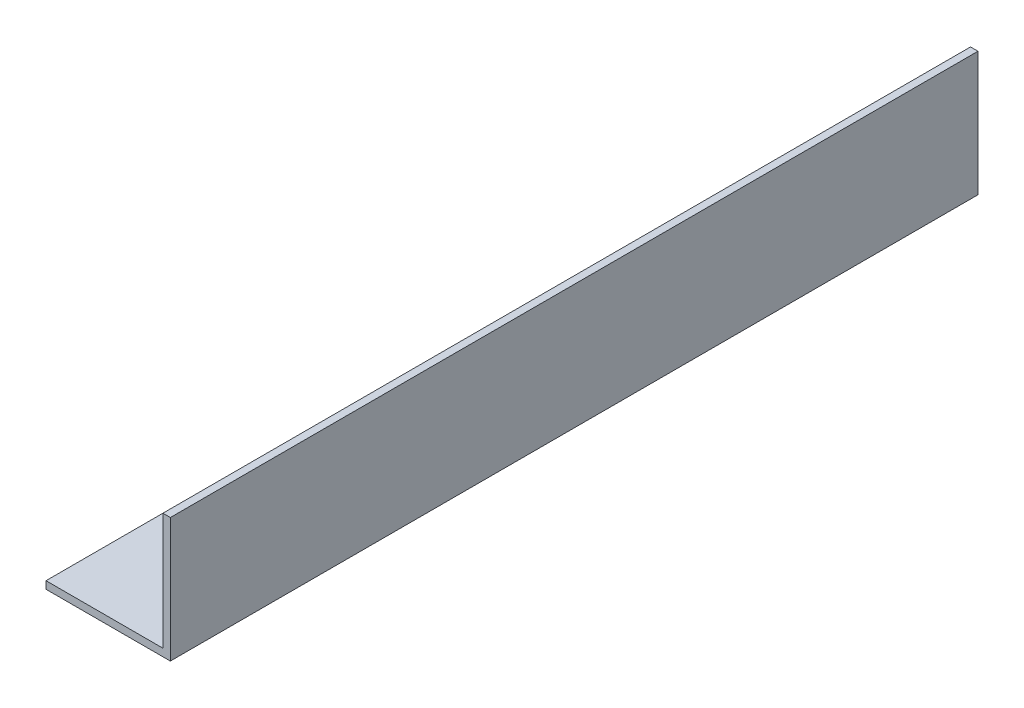
from build123d import *

# Parameters (mm, degrees)
BOSS_EXTRUDE1_DEPTH      = 20
BOSS_EXTRUDE1_DEPTH_BACK = 304.8
SKETCH4_R                = 2.585
CUT_EXTRUDE1_DEPTH       = 313.894614847


with BuildPart() as part:
    # Sketch3 → Boss-Extrude1 (new, two sides: drawn at the far end of the back side and taken through both)
    with BuildSketch(Plane.XY.offset(-BOSS_EXTRUDE1_DEPTH_BACK)):
        Polygon((-50, 0), (0, 0), (0, 50), (-3, 50), (-3, 3), (-50, 3), align=None)
    extrude(amount=BOSS_EXTRUDE1_DEPTH + BOSS_EXTRUDE1_DEPTH_BACK)

    # Sketch4 → Cut-Extrude1 (cut, through all)
    with BuildSketch(Plane(origin=(0, 0, 0), x_dir=(1, 0, 0), z_dir=(0, 1, 0))):
        with Locations(Location((-37, 151.19, 0), (0, 0, 180))):
            Circle(SKETCH4_R)
        with Locations(Location((-16, 151.19, 0), (0, 0, 90))):
            Circle(SKETCH4_R)
        with Locations(Location((-37, 179.19, 0), (0, 0, 180))):
            Circle(SKETCH4_R)
        with Locations(Location((-16, 179.19, 0), (0, 0, 90))):
            Circle(SKETCH4_R)
        with Locations(Location((-37, 105.61, 0), (0, 0, 90))):
            Circle(SKETCH4_R)
        with Locations(Location((-16, 105.61, 0), (0, 0, 180))):
            Circle(SKETCH4_R)
        with Locations(Location((-16, 133.61, 0), (0, 0, 180))):
            Circle(SKETCH4_R)
        with Locations(Location((-37, 133.61, 0), (0, 0, 90))):
            Circle(SKETCH4_R)
    extrude(amount=CUT_EXTRUDE1_DEPTH, mode=Mode.SUBTRACT)


solid = part.part
